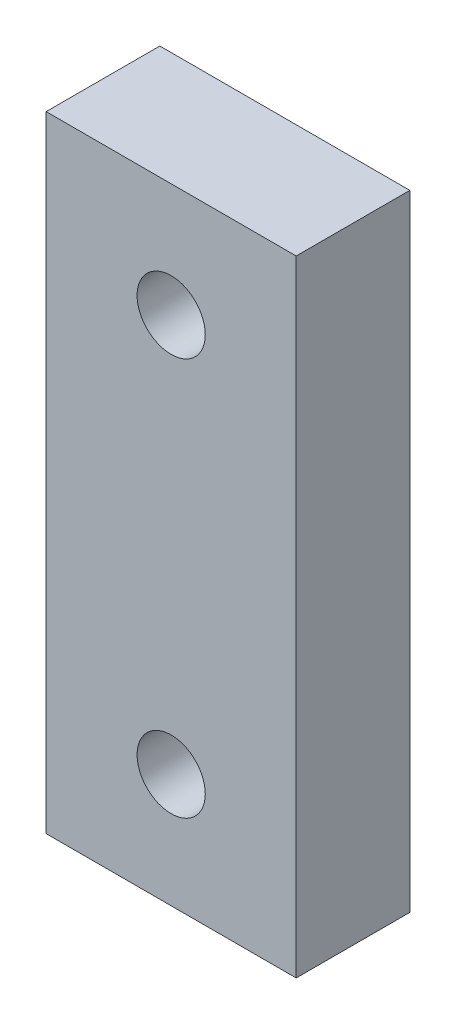
from build123d import *

# Parameters (mm, degrees)
SKETCH1_W           = 11
SKETCH1_H           = 27.51
BOSS_EXTRUDE2_DEPTH = 5
SKETCH3_R           = 1.5
CUT_EXTRUDE1_DEPTH  = 5


with BuildPart() as part:
    # Sketch1 → Boss-Extrude2 (new body)
    with BuildSketch(Plane.XY):
        Rectangle(SKETCH1_W, SKETCH1_H)
    extrude(amount=BOSS_EXTRUDE2_DEPTH)

    # Sketch3 → Cut-Extrude1 (cut)
    with BuildSketch(Plane.XY.offset(5)):
        with Locations((0, 8.755)):
            Circle(SKETCH3_R)
        with Locations((0, -8.745)):
            Circle(SKETCH3_R)
    extrude(amount=-CUT_EXTRUDE1_DEPTH, mode=Mode.SUBTRACT)


solid = part.part
